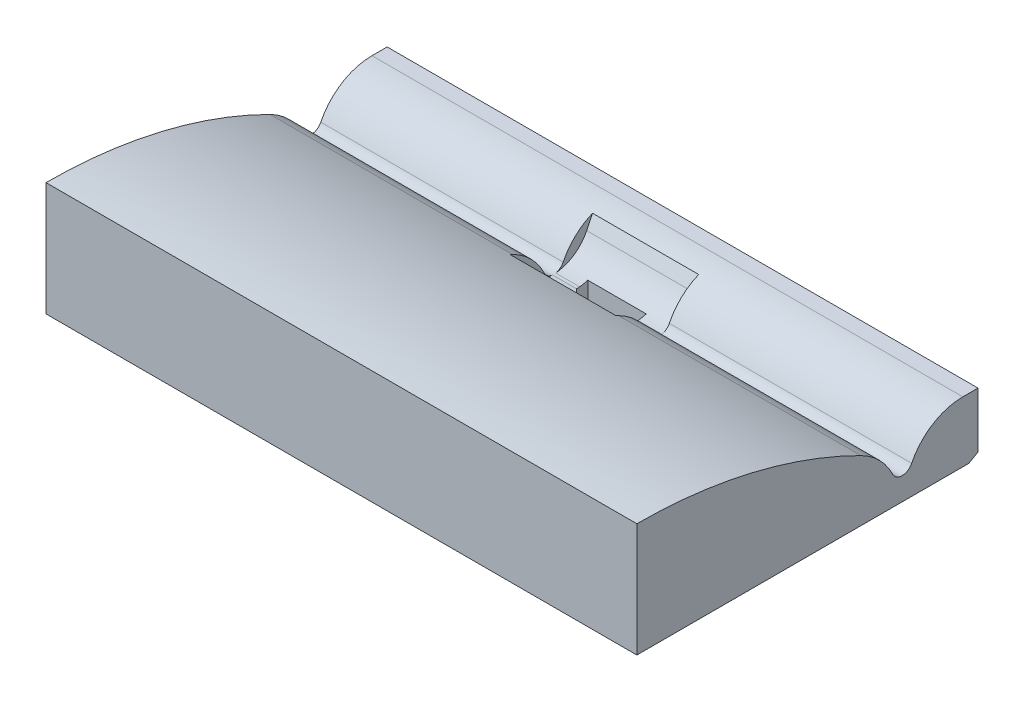
from build123d import *

# Parameters (mm, degrees)
EXTRUDE_1509_DEPTH      = 38.971143
EXTRUDE_1509_DEPTH_BACK = 38.971143
USB_REACH               = 62.065
CUT_EXTRUDE_2243_DEPTH  = 7


with BuildPart() as part:
    # Эскиз1 → Extrude 1509 (new, two sides: drawn at the far end of the back side and taken through both)
    with BuildSketch(Plane(origin=(0, 0, 0), x_dir=(0, 0, -1), z_dir=(1, 0, 0)).offset(-EXTRUDE_1509_DEPTH_BACK)):
        with BuildLine():
            Line((0, 60.5), (-2, 60.5))
            ThreePointArc((-2, 60.5), (-5.97996079, 59.358562264), (-8.75, 56.28125))
            ThreePointArc((-8.75, 56.28125), (-10, 55.5), (-11.25, 56.28125))
            ThreePointArc((-11.25, 56.28125), (-12.988798615, 58.733904838), (-15.421871621, 60.5))
            ThreePointArc((-15.421871621, 60.5), (-29.802420601, 65.726159332), (-45, 67.5))
            Line((-45, 67.5), (-45, 52.5))
            Line((-45, 52.5), (-1.212435565, 52.5))
            Line((-1.212435565, 52.5), (0, 53.2))
            Line((0, 53.2), (0, 60.5))
        make_face()
    extrude(amount=EXTRUDE_1509_DEPTH + EXTRUDE_1509_DEPTH_BACK)

    # Эскиз3 → Вырез под USB (cut, up to next)
    with BuildSketch(Plane(origin=(0, 60.5, 0), x_dir=(1, 0, 0), z_dir=(0, 1, 0)), mode=Mode.PRIVATE) as usb_sk1:
        Polygon((3.85, -8.65), (-3.85, -8.65), (-3.85, -10.15), (-2.65, -11.35), (2.65, -11.35), (3.85, -10.15), align=None)
    usb_tool1 = extrude(usb_sk1.sketch, amount=-USB_REACH, mode=Mode.PRIVATE) & part.part
    add(usb_tool1.solids().sort_by_distance((0, 60.5, 9.929302))[0], mode=Mode.SUBTRACT)

    # Эскиз4 → Cut-Extrude 2243 (cut, symmetric)
    with BuildSketch(Plane(origin=(0, 0, 0), x_dir=(0, 0, -1), z_dir=(1, 0, 0))):
        with BuildLine():
            Line((-5.65, 58.328664085), (-1.315214811, 67.278875413))
            Line((-1.315214811, 67.278875413), (-18.984785189, 67.278875413))
            Line((-18.984785189, 67.278875413), (-14.65, 58.328664085))
            ThreePointArc((-14.65, 58.328664085), (-10.15, 55.508113557), (-5.65, 58.328664085))
        make_face()
    extrude(amount=CUT_EXTRUDE_2243_DEPTH, both=True, mode=Mode.SUBTRACT)


solid = part.part
